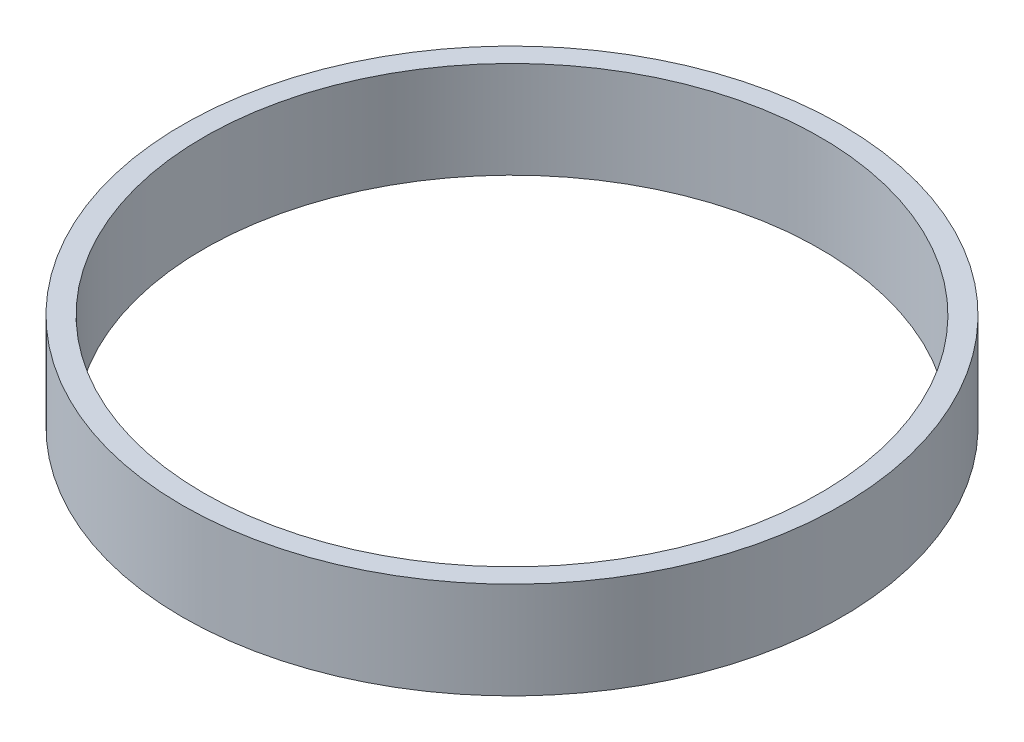
from build123d import *

# Parameters (mm, degrees)
SKETCH1_R           = 34.05
SKETCH1_R_2         = 31.85
BOSS_EXTRUDE1_DEPTH = 10


with BuildPart() as part:
    # Sketch1 → Boss-Extrude1 (new body)
    with BuildSketch(Plane(origin=(0, 0, 0), x_dir=(1, 0, 0), z_dir=(0, 1, 0))):
        with Locations(Location((0, 0, 0), (0, 0, 270))):
            Circle(SKETCH1_R)
        with Locations(Location((0, 0, 0), (0, 0, 270))):
            Circle(SKETCH1_R_2, mode=Mode.SUBTRACT)
    extrude(amount=BOSS_EXTRUDE1_DEPTH)


solid = part.part
